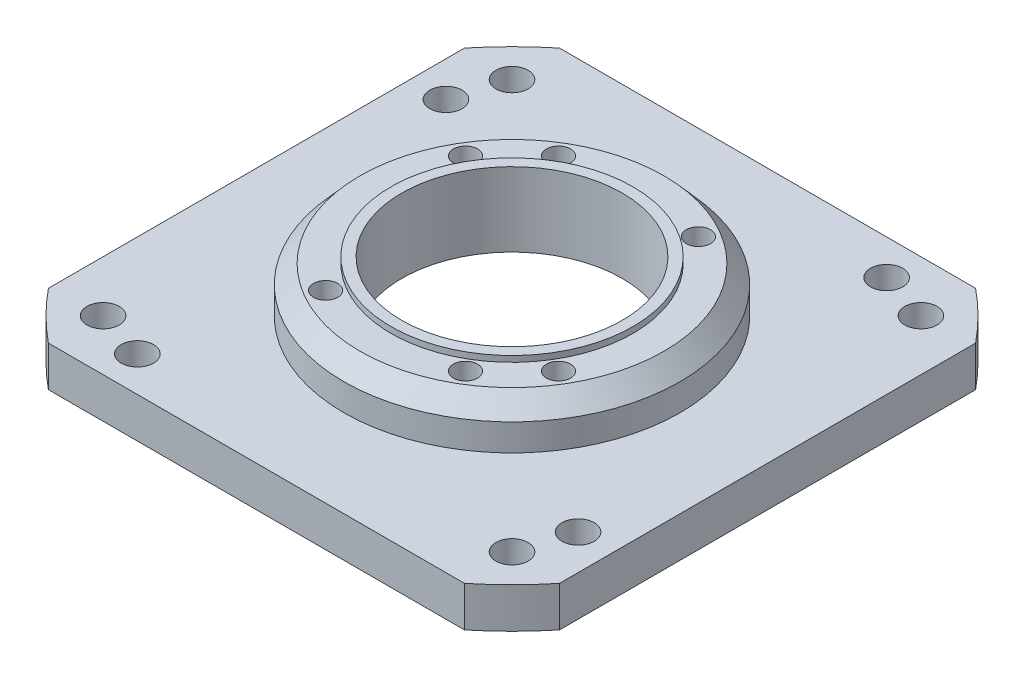
from build123d import *

# Parameters (mm, degrees)
BOSS_EXTRUDE1_DEPTH                    = 44
CBORE_FOR_M8_HEX_HEAD_BOLT1_AT_2_COUNT = 2
CBORE_FOR_M8_HEX_HEAD_BOLT1_AT_2_PITCH = 52
CBORE_FOR_M8_HEX_HEAD_BOLT1_AT_3_COUNT = 2
CBORE_FOR_M8_HEX_HEAD_BOLT1_AT_3_PITCH = 71.4177849
CBORE_FOR_M8_HEX_HEAD_BOLT1_AT_4_COUNT = 2
CBORE_FOR_M8_HEX_HEAD_BOLT1_AT_4_PITCH = 101
CBORE_FOR_M8_HEX_HEAD_BOLT1_AT_5_COUNT = 2
CBORE_FOR_M8_HEX_HEAD_BOLT1_AT_5_PITCH = 86.585218138
CBORE_FOR_M8_HEX_HEAD_BOLT1_AT_6_COUNT = 2
CBORE_FOR_M8_HEX_HEAD_BOLT1_AT_6_PITCH = 71.4177849
SKETCH9_W                              = 236.92276851
SKETCH9_H                              = 228.212372608
CUT_EXTRUDE1_DEPTH                     = 10
SKETCH8_R                              = 6
CUT_EXTRUDE2_DEPTH                     = 139.585713549


with BuildPart() as part:
    # Sketch1 → Boss-Extrude1 (new body)
    with BuildSketch(Plane(origin=(0, 0, 0), x_dir=(1, 0, 0), z_dir=(0, 1, 0))):
        with BuildLine():
            Line((77.338541491, -95), (-77.338541491, -95))
            ThreePointArc((-77.338541491, -95), (-86.620580695, -86.620580695), (-95, -77.338541491))
            Line((-95, -77.338541491), (-95, 77.338541491))
            ThreePointArc((-95, 77.338541491), (-86.620580695, 86.620580695), (-77.338541491, 95))
            Line((-77.338541491, 95), (77.338541491, 95))
            ThreePointArc((77.338541491, 95), (86.620580695, 86.620580695), (95, 77.338541491))
            Line((95, 77.338541491), (95, -77.338541491))
            ThreePointArc((95, -77.338541491), (86.620580695, -86.620580695), (77.338541491, -95))
        make_face()
    extrude(amount=BOSS_EXTRUDE1_DEPTH)

    # Sketch2 → Cut-Revolve3 (revolve, cut)
    with BuildSketch(Plane(origin=(0, 0, 0), x_dir=(0, 0, -1), z_dir=(1, 0, 0))):
        Polygon((90, 0), (90, 10), (60, 10), (60, 16.5), (41, 16.5), (41, 44), (0, 44), (0, 0), align=None)
    revolve(axis=Axis((0, 0, 0), (0, 1, 0)), mode=Mode.SUBTRACT)

    # Sketch3 → Cut-Revolve6 (revolve, cut)
    with BuildSketch(Plane(origin=(0, 0, 0), x_dir=(0, 0, -1), z_dir=(1, 0, 0))):
        Polygon((132.5, 25), (62.5, 25), (62.5, 35), (56.5, 41.8), (45, 41.8), (45, 44), (132.5, 44), align=None)
    revolve(axis=Axis((0, 0, 0), (0, 1, 0)), mode=Mode.SUBTRACT)

    # Sketch7 → CBORE for M8 Hex Head Bolt1 (revolve, cut)
    with BuildSketch(Plane(origin=(26, 16.5, -43.292609069), x_dir=(0, 0, -1), z_dir=(1, 0, 0))):
        Polygon((0, 0), (0, 27.5), (4.5, 27.5), (4.5, 13.025), (4.525, 13), (6.5, 13), (6.5, 0), align=None)
    cbore_for_m8_hex_head_bolt1 = revolve(axis=Axis((26, 10.15, -43.292609069), (0, 1, 0)), mode=Mode.SUBTRACT)

    # CBORE for M8 Hex Head Bolt1 at 2: CBORE for M8 Hex Head Bolt1 ×2
    with Locations(*[(-i * CBORE_FOR_M8_HEX_HEAD_BOLT1_AT_2_PITCH, 0, 0) for i in range(1, CBORE_FOR_M8_HEX_HEAD_BOLT1_AT_2_COUNT)]):
        add(cbore_for_m8_hex_head_bolt1, mode=Mode.SUBTRACT)

    # CBORE for M8 Hex Head Bolt1 at 3: CBORE for M8 Hex Head Bolt1 ×2
    with Locations(*[Vector(-0.9702430447284767, 0, 0.24213309182351622) * (i * CBORE_FOR_M8_HEX_HEAD_BOLT1_AT_3_PITCH) for i in range(1, CBORE_FOR_M8_HEX_HEAD_BOLT1_AT_3_COUNT)]):
        add(cbore_for_m8_hex_head_bolt1, mode=Mode.SUBTRACT)

    # CBORE for M8 Hex Head Bolt1 at 4: CBORE for M8 Hex Head Bolt1 ×2
    with Locations(*[Vector(-0.514851485148515, 0, 0.8572793875046621) * (i * CBORE_FOR_M8_HEX_HEAD_BOLT1_AT_4_PITCH) for i in range(1, CBORE_FOR_M8_HEX_HEAD_BOLT1_AT_4_COUNT)]):
        add(cbore_for_m8_hex_head_bolt1, mode=Mode.SUBTRACT)

    # CBORE for M8 Hex Head Bolt1 at 5: CBORE for M8 Hex Head Bolt1 ×2
    with Locations(*[(0, 0, i * CBORE_FOR_M8_HEX_HEAD_BOLT1_AT_5_PITCH) for i in range(1, CBORE_FOR_M8_HEX_HEAD_BOLT1_AT_5_COUNT)]):
        add(cbore_for_m8_hex_head_bolt1, mode=Mode.SUBTRACT)

    # CBORE for M8 Hex Head Bolt1 at 6: CBORE for M8 Hex Head Bolt1 ×2
    with Locations(*[Vector(0.24213309182351628, 0, 0.9702430447284767) * (i * CBORE_FOR_M8_HEX_HEAD_BOLT1_AT_6_PITCH) for i in range(1, CBORE_FOR_M8_HEX_HEAD_BOLT1_AT_6_COUNT)]):
        add(cbore_for_m8_hex_head_bolt1, mode=Mode.SUBTRACT)

    # Sketch9 → Cut-Extrude1 (cut)
    with BuildSketch(Plane.XZ.offset(-10)):
        Rectangle(SKETCH9_W, SKETCH9_H)
    extrude(amount=CUT_EXTRUDE1_DEPTH, mode=Mode.SUBTRACT)

    # Sketch8 → Cut-Extrude2 (cut, through all)
    with BuildSketch(Plane.XZ.offset(-10)):
        with Locations(Location((76.013978978, 76.013978978, 0), (0, 0, 270))):
            Circle(SKETCH8_R)
        with Locations(Location((81.915204429, 57.357643635, 0), (0, 0, 270))):
            Circle(SKETCH8_R)
        with Locations(Location((76.013978978, -76.013978978, 0), (0, 0, 270))):
            Circle(SKETCH8_R)
        with Locations(Location((57.357643635, -81.915204429, 0), (0, 0, 270))):
            Circle(SKETCH8_R)
        with Locations(Location((-76.013978978, -76.013978978, 0), (0, 0, 270))):
            Circle(SKETCH8_R)
        with Locations(Location((-81.915204429, -57.357643635, 0), (0, 0, 270))):
            Circle(SKETCH8_R)
        with Locations(Location((-76.013978978, 76.013978978, 0), (0, 0, 270))):
            Circle(SKETCH8_R)
        with Locations(Location((-57.357643635, 81.915204429, 0), (0, 0, 270))):
            Circle(SKETCH8_R)
    extrude(amount=-CUT_EXTRUDE2_DEPTH, mode=Mode.SUBTRACT)


solid = part.part
